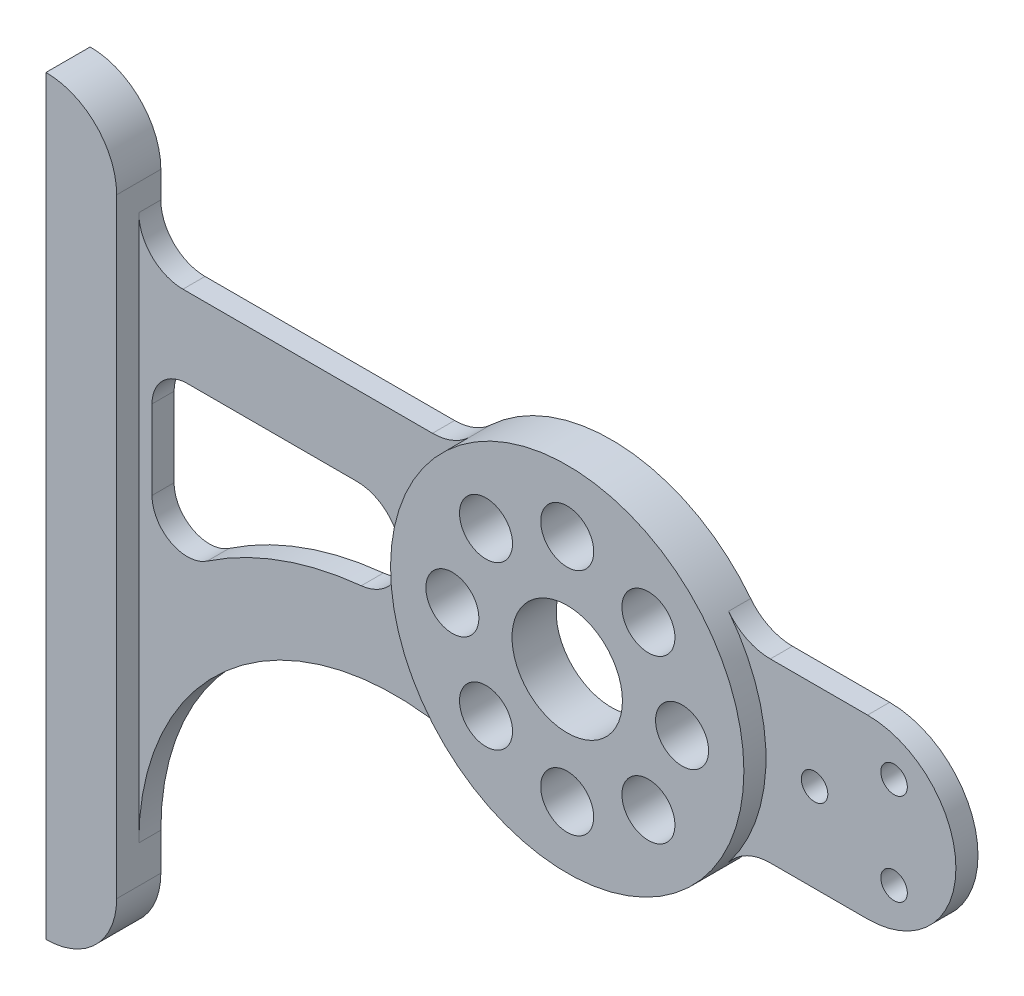
from build123d import *

# Parameters (mm, degrees)
SKETCH_2_R        = 3
EXTRUDE_1_DEPTH   = 5
EXTRUDE_1_2_DEPTH = 5
SKETCH_2_3_R      = 40
SKETCH_2_3_R_2    = 6
SKETCH_2_3_R_3    = 12.5
EXTRUDE_2_DEPTH   = 10


with BuildPart() as part:
    # Эскиз2 → Бобышка-Вытянуть1 (new body)
    with BuildSketch(Plane.XY):
        with BuildLine():
            ThreePointArc((63, -20), (83, 0), (63, 20))
            Line((63, 20), (40.987803064, 20))
            ThreePointArc((40.987803064, 20), (35.725454948, 21.215395589), (31.52907928, 24.615384615))
            ThreePointArc((31.52907928, 24.615384615), (40, 0), (31.52907928, -24.615384615))
            ThreePointArc((31.52907928, -24.615384615), (35.725454948, -21.215395589), (40.987803064, -20))
            Line((40.987803064, -20), (63, -20))
        make_face()
        with Locations((69, -10.392304845)):
            Circle(SKETCH_2_R, mode=Mode.SUBTRACT)
        with Locations((51, 0)):
            Circle(SKETCH_2_R, mode=Mode.SUBTRACT)
        with Locations((69, 10.392304845)):
            Circle(SKETCH_2_R, mode=Mode.SUBTRACT)
    extrude(amount=EXTRUDE_1_DEPTH)



with BuildPart() as body_2:
    # Эскиз2 → Extrude 1 2 (new body)
    with BuildSketch(Plane.XY):
        with BuildLine():
            ThreePointArc((-17.959183673, -35.741680455), (-39.592499474, -5.695084317), (-27.304983614, 29.230769231))
            ThreePointArc((-27.304983614, 29.230769231), (-31.093682384, 26.836873887), (-35.496478699, 26))
            Line((-35.496478699, 26), (-92, 26))
            ThreePointArc((-92, 26), (-99.071067812, 28.928932188), (-102, 36))
            Line((-102, 36), (-102, -87.567117116))
            ThreePointArc((-102, -87.567117116), (-74.443658232, -38.199276638), (-17.959183673, -35.741680455))
        make_face()
        with BuildLine():
            ThreePointArc((-99, 0), (-96.656854249, 5.656854249), (-91, 8))
            Line((-91, 8), (-52.617915552, 8))
            ThreePointArc((-52.617915552, 8), (-42.630507284, -1.498326705), (-51.615832348, -11.949664781))
            ThreePointArc((-51.615832348, -11.949664781), (-69.852655287, -16.099360648), (-86.523809524, -24.577232027))
            ThreePointArc((-86.523809524, -24.577232027), (-94.754362542, -25.011048058), (-99, -17.946717807))
            Line((-99, -17.946717807), (-99, 0))
        make_face(mode=Mode.SUBTRACT)
    extrude(amount=EXTRUDE_1_2_DEPTH)


with BuildPart() as part_1:
    add(part.part)

    add(body_2.part)  # Бобышка-Вытянуть2 merges body 2
    # Эскиз2<3> → Бобышка-Вытянуть2 (add)
    # profile 1 of 2: a face of its own
    with BuildSketch(Plane.XY):
        Circle(SKETCH_2_3_R)
        with Locations((-18.384776311, -18.384776311)):
            Circle(SKETCH_2_3_R_2, mode=Mode.SUBTRACT)
        with Locations((-26, 0)):
            Circle(SKETCH_2_3_R_2, mode=Mode.SUBTRACT)
        with Locations((-18.384776311, 18.384776311)):
            Circle(SKETCH_2_3_R_2, mode=Mode.SUBTRACT)
        with Locations((0, -26)):
            Circle(SKETCH_2_3_R_2, mode=Mode.SUBTRACT)
        with Locations((18.384776311, -18.384776311)):
            Circle(SKETCH_2_3_R_2, mode=Mode.SUBTRACT)
        Circle(SKETCH_2_3_R_3, mode=Mode.SUBTRACT)
        with Locations((26, 0)):
            Circle(SKETCH_2_3_R_2, mode=Mode.SUBTRACT)
        with Locations((0, 26)):
            Circle(SKETCH_2_3_R_2, mode=Mode.SUBTRACT)
        with Locations((18.384776311, 18.384776311)):
            Circle(SKETCH_2_3_R_2, mode=Mode.SUBTRACT)
    # profile 2 of 2: a face of its own
    with BuildSketch(Plane.XY):
        with BuildLine():
            Line((-102, -96), (-102, 42))
            ThreePointArc((-102, 42), (-106.686291501, 53.313708499), (-118, 58))
            Line((-118, 58), (-118, -112))
            ThreePointArc((-118, -112), (-106.686291501, -107.313708499), (-102, -96))
        make_face()
    extrude(amount=EXTRUDE_2_DEPTH)


solid = part_1.part
